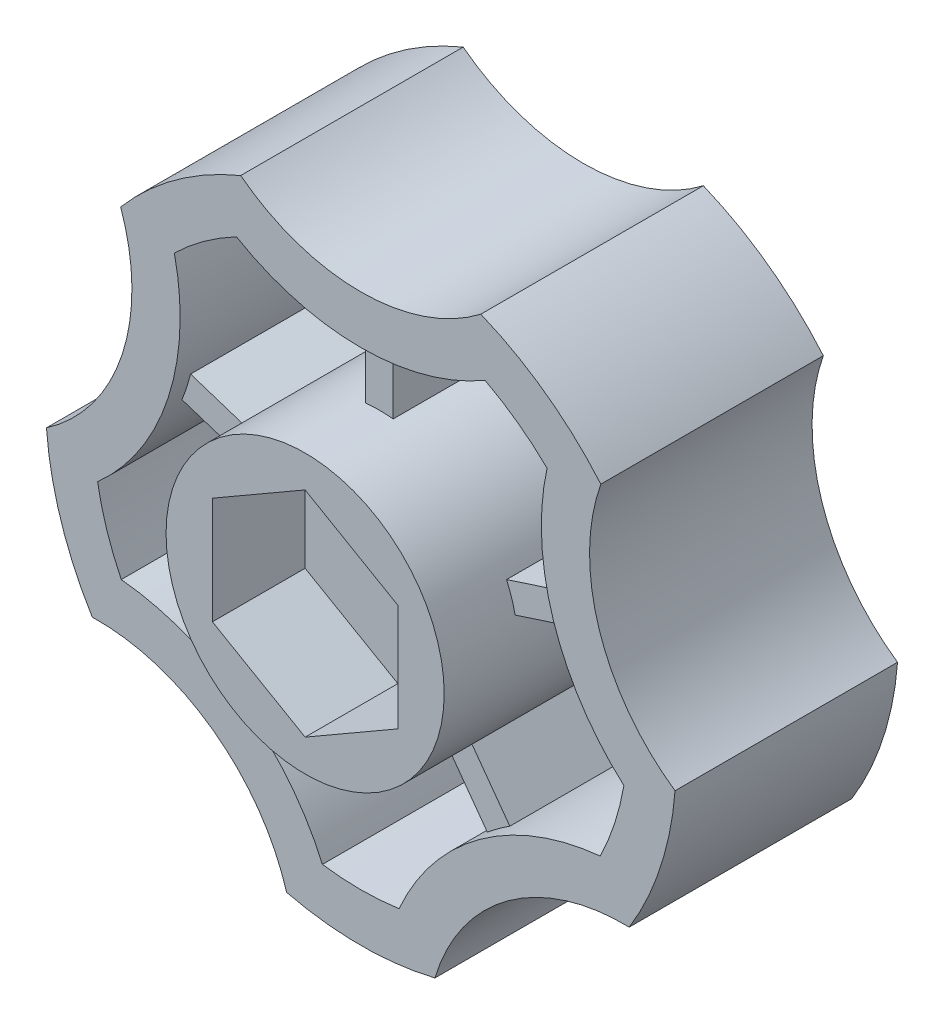
from build123d import *

# Parameters (mm, degrees)
BOSS_EXTRU_1_DEPTH           = 12
COQUE1_T                     = -2.6
ESQUISSE4_R                  = 7.5
BOSS_EXTRU_2_DEPTH           = 12.4
NERVURE1_REACH               = 28.407
ESQUISSE6_WALLS_W            = 1.5
ESQUISSE6_WALLS_H            = 61.384627196
R_P_TITION_CIRCULAIRE1_COUNT = 5
ESQUISSE7_R                  = 6
ENL_V_MAT_EXTRU_1_DEPTH      = 4.5
ENL_V_MAT_EXTRU_2_DEPTH      = 5


with BuildPart() as part:
    # Esquisse1 → Boss.-Extru.1 (new body)
    with BuildSketch(Plane.XY):
        with BuildLine():
            ThreePointArc((-6.475738253, 15.718295521), (-9.992349289, 13.753288904), (-12.947874208, 11.016013502))
            ThreePointArc((-12.947874208, 11.016013502), (-12.861203675, 4.178858391), (-16.950100551, -1.301572625))
            ThreePointArc((-16.950100551, -1.301572625), (-16.167960777, -5.253288904), (-14.477964596, -8.910024756))
            ThreePointArc((-14.477964596, -8.910024756), (-7.948661008, -10.940393303), (-4, -16.522711642))
            ThreePointArc((-4, -16.522711642), (0, -17), (4, -16.522711642))
            ThreePointArc((4, -16.522711642), (7.948661008, -10.940393303), (14.477964596, -8.910024756))
            ThreePointArc((14.477964596, -8.910024756), (16.167960777, -5.253288904), (16.950100551, -1.301572625))
            ThreePointArc((16.950100551, -1.301572625), (12.861203675, 4.178858391), (12.947874208, 11.016013502))
            ThreePointArc((12.947874208, 11.016013502), (9.992349289, 13.753288904), (6.475738253, 15.718295521))
            ThreePointArc((6.475738253, 15.718295521), (0, 13.523069823), (-6.475738253, 15.718295521))
        make_face()
    extrude(amount=BOSS_EXTRU_1_DEPTH)

    # Coque1
    coque1_openings = [part.faces().sort_by_distance(p)[0] for p in [
        (0, 0, 12),
    ]]
    offset(amount=COQUE1_T, openings=coque1_openings, kind=Kind.INTERSECTION)

    # Esquisse4 → Boss.-Extru.2 (add)
    with BuildSketch(Plane.XY.offset(15)):
        Circle(ESQUISSE4_R)
    extrude(amount=-BOSS_EXTRU_2_DEPTH)

    # Esquisse6 walls → Nervure1 (add, up to next)
    with BuildSketch(Plane.XY.offset(11), mode=Mode.PRIVATE) as nervure1_sk1:
        with Locations((0, 9.152971246)):
            Rectangle(ESQUISSE6_WALLS_W, ESQUISSE6_WALLS_H)
    nervure1_tool1 = extrude(nervure1_sk1.sketch, amount=-NERVURE1_REACH, mode=Mode.PRIVATE) - part.part
    nervure1 = nervure1_tool1.solids().sort_by_distance((0, 9.152971246, 11))[0]
    add(nervure1)

    # Répétition circulaire1: Nervure1 ×5 about axis
    r_p_tition_circulaire1_axis = Axis((0, 0, 0), (0, 0, 1))
    for i in range(1, R_P_TITION_CIRCULAIRE1_COUNT):
        add(nervure1.rotate(r_p_tition_circulaire1_axis, i * 360 / R_P_TITION_CIRCULAIRE1_COUNT))

    # Esquisse7 → Enlèv. mat.-Extru.1 (cut)
    with BuildSketch(Plane(origin=(0, 0, 0), x_dir=(-1, 0, 0), z_dir=(0, 0, -1))):
        Circle(ESQUISSE7_R)
    extrude(amount=-ENL_V_MAT_EXTRU_1_DEPTH, mode=Mode.SUBTRACT)

    # Esquisse8 → Enlèv. mat.-Extru.2 (cut)
    with BuildSketch(Plane.XY.offset(15)):
        Polygon((-5, 2.886751346), (-5, -2.886751346), (0, -5.773502692), (5, -2.886751346), (5, 2.886751346), (0, 5.773502692), align=None)
    extrude(amount=-ENL_V_MAT_EXTRU_2_DEPTH, mode=Mode.SUBTRACT)


solid = part.part
